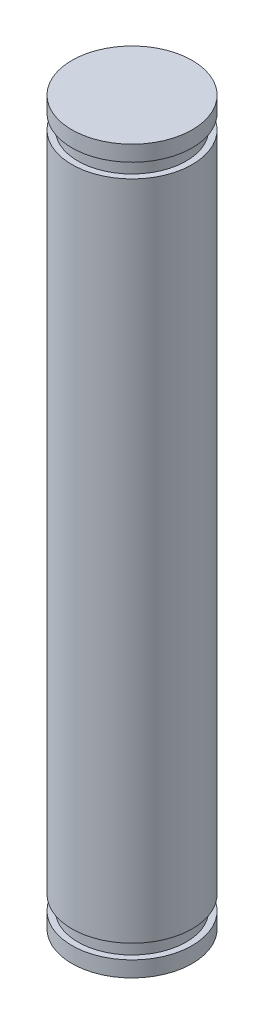
from build123d import *


with BuildPart() as part:
    # 草图1 → 旋转1 (revolve)
    with BuildSketch(Plane.XY, mode=Mode.PRIVATE) as revolve_1_sk:
        Polygon((-6.955644483, 16.114936393), (-11.955644483, 16.114936393), (-11.955644483, 76.114936393), (-6.955644483, 76.114936393), (-6.955644483, 74.814936393), (-7.455644483, 74.814936393), (-7.455644483, 73.614936393), (-6.955644483, 73.614936393), (-6.955644483, 18.614936393), (-7.455644483, 18.614936393), (-7.455644483, 17.414936393), (-6.955644483, 17.414936393), align=None)
    revolve(revolve_1_sk.sketch.rotate(Axis((-11.955644483, 16.114936393, 0), (0, 1, 0)), 90), axis=Axis((-11.955644483, 16.114936393, 0), (0, 1, 0)))


solid = part.part
